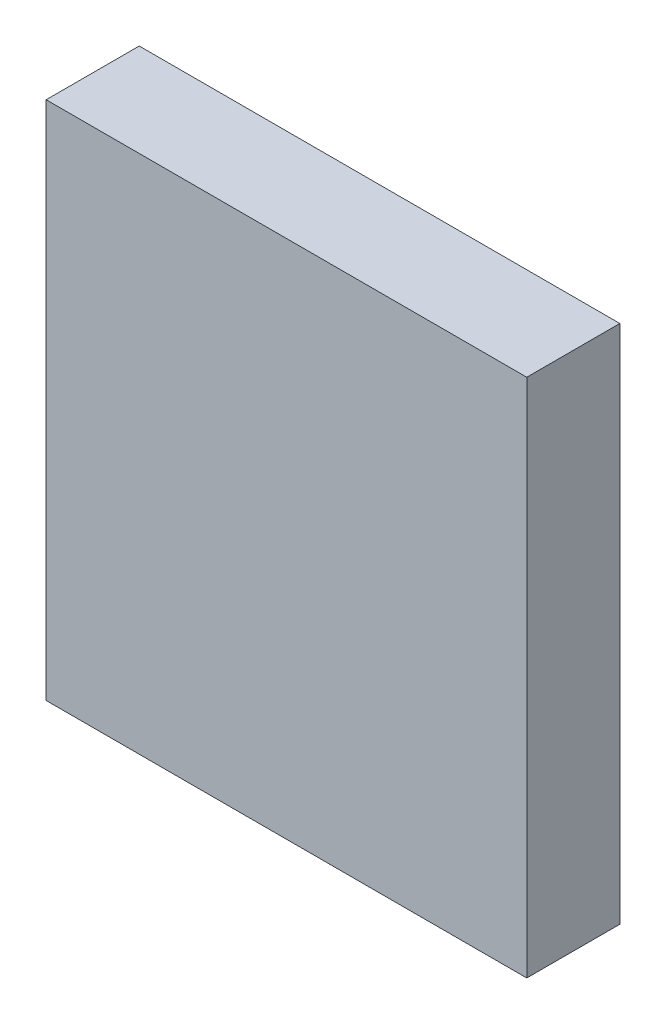
from build123d import *

# Parameters (mm, degrees)
SKETCH1_W               = 5.163566
SKETCH1_H               = 5.590066
COMPONENT_OUTLINE_DEPTH = 1


with BuildPart() as part:
    # Sketch1 → Component_Outline (new body)
    with BuildSketch(Plane.XY):
        with Locations((-0.308283, -0.204967)):
            Rectangle(SKETCH1_W, SKETCH1_H)
    extrude(amount=COMPONENT_OUTLINE_DEPTH)


solid = part.part
